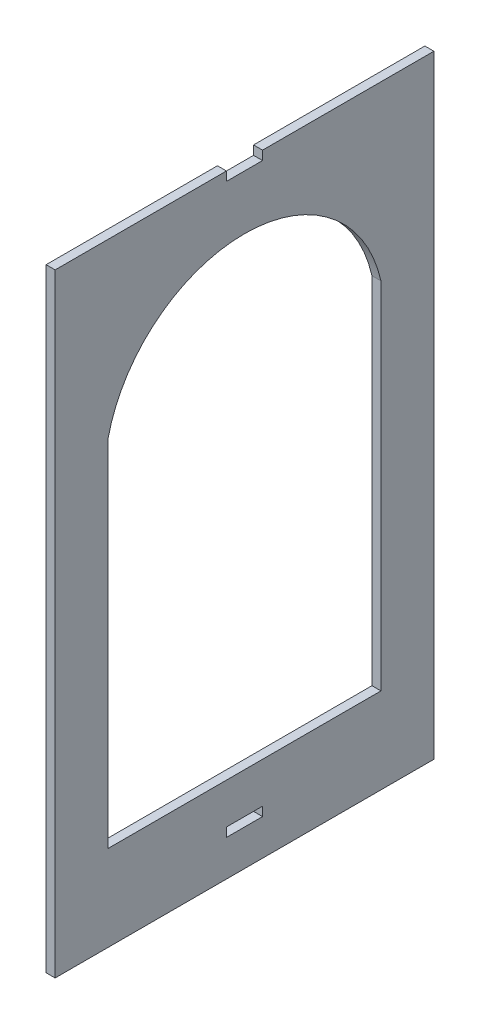
from build123d import *

# Parameters (mm, degrees)
SKETCH1_W           = 25.4
SKETCH1_H           = 6.35
BOSS_EXTRUDE1_DEPTH = 6.35


with BuildPart() as part:
    # Sketch1 → Boss-Extrude1 (new body)
    with BuildSketch(Plane(origin=(0, 0, 0), x_dir=(0, 0, -1), z_dir=(1, 0, 0))):
        Polygon((12.7, 215.9), (133.35, 215.9), (133.35, -215.9), (-133.35, -215.9), (-133.35, 215.9), (-12.7, 215.9), (-12.7, 209.55), (12.7, 209.55), align=None)
        with Locations((0, -187.325)):
            Rectangle(SKETCH1_W, SKETCH1_H, mode=Mode.SUBTRACT)
        with BuildLine():
            Line((-96.07, 94.458095238), (-96.07, -155.541904762))
            Line((-96.07, -155.541904762), (96.07, -155.541904762))
            Line((96.07, -155.541904762), (96.07, 94.458095238))
            ThreePointArc((96.07, 94.458095238), (0, 171.288491158), (-96.07, 94.458095238))
        make_face(mode=Mode.SUBTRACT)
    extrude(amount=BOSS_EXTRUDE1_DEPTH)


solid = part.part
